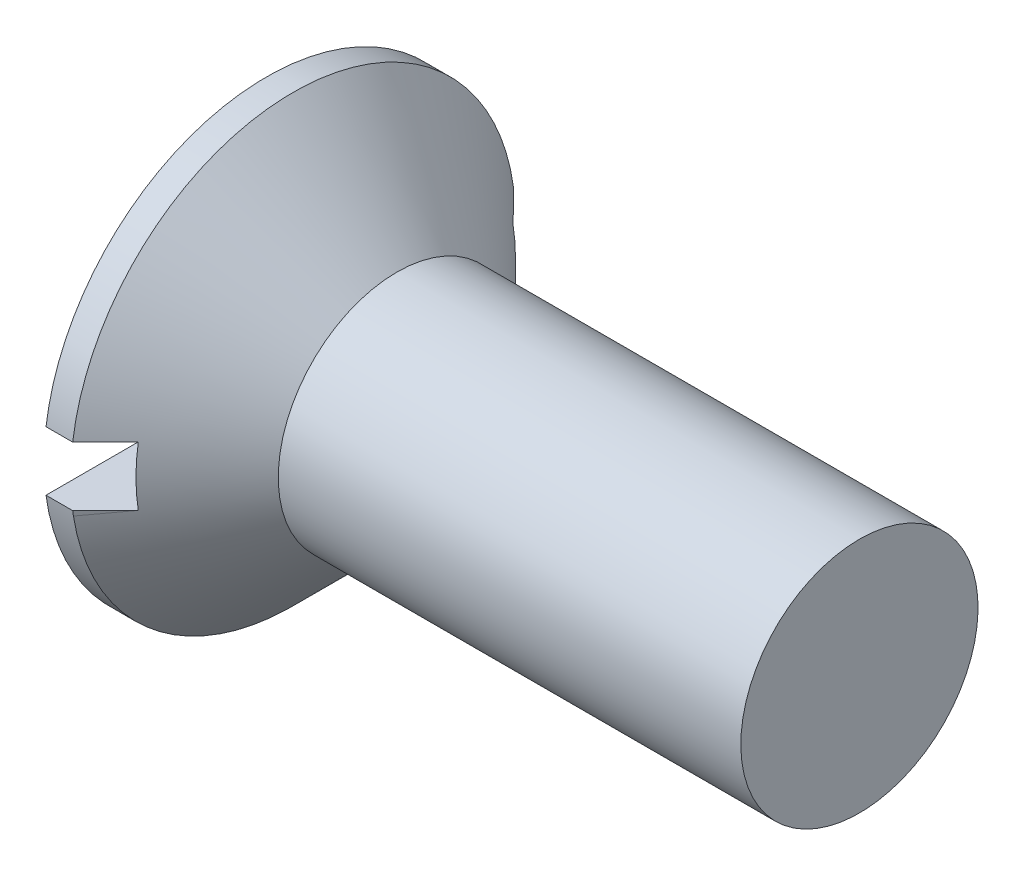
from build123d import *

# Parameters (mm, degrees)
SKETCH2_W          = 7.5
SKETCH2_H          = 1
CUT_EXTRUDE1_DEPTH = 1


with BuildPart() as part:
    # Sketch1 → Revolve1 (revolve)
    with BuildSketch(Plane.XY):
        Polygon((0, 0), (0, 3.75), (0.45, 3.75), (2.2, 2), (10, 2), (10, 0), align=None)
    revolve(axis=Axis((10, 0, 0), (-1, 0, 0)))

    # Sketch2 → Cut-Extrude1 (cut)
    with BuildSketch(Plane.ZY):
        Rectangle(SKETCH2_W, SKETCH2_H)
    extrude(amount=-CUT_EXTRUDE1_DEPTH, mode=Mode.SUBTRACT)


solid = part.part
